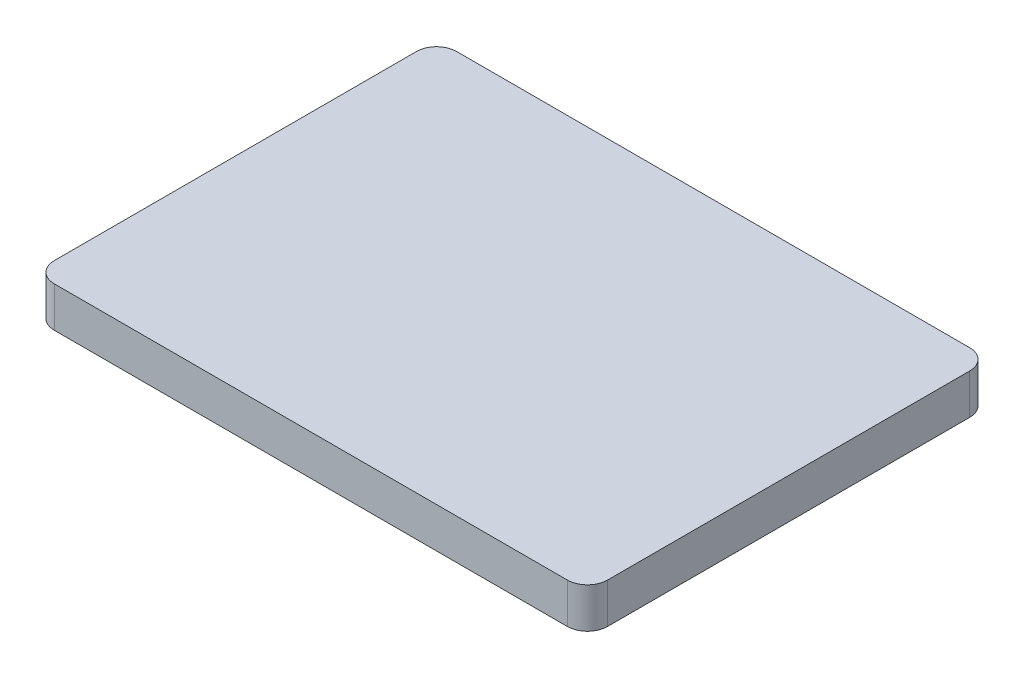
from build123d import *

# Parameters (mm, degrees)
SKETCH1_W           = 5.5
SKETCH1_H           = 4
BOSS_EXTRUDE1_DEPTH = 0.4
FILLET1_R           = 0.2


with BuildPart() as part:
    # Sketch1 → Boss-Extrude1 (new body)
    with BuildSketch(Plane(origin=(0, 0, 0), x_dir=(1, 0, 0), z_dir=(0, 1, 0))):
        Rectangle(SKETCH1_W, SKETCH1_H)
    extrude(amount=BOSS_EXTRUDE1_DEPTH)

    # Fillet1
    fillet1_edges = [part.edges().sort_by_distance(p)[0] for p in [
        (2.75, 0.2, 2),
        (-2.75, 0.2, 2),
        (-2.75, 0.2, -2),
        (2.75, 0.2, -2),
    ]]
    fillet(fillet1_edges, radius=FILLET1_R)


solid = part.part
